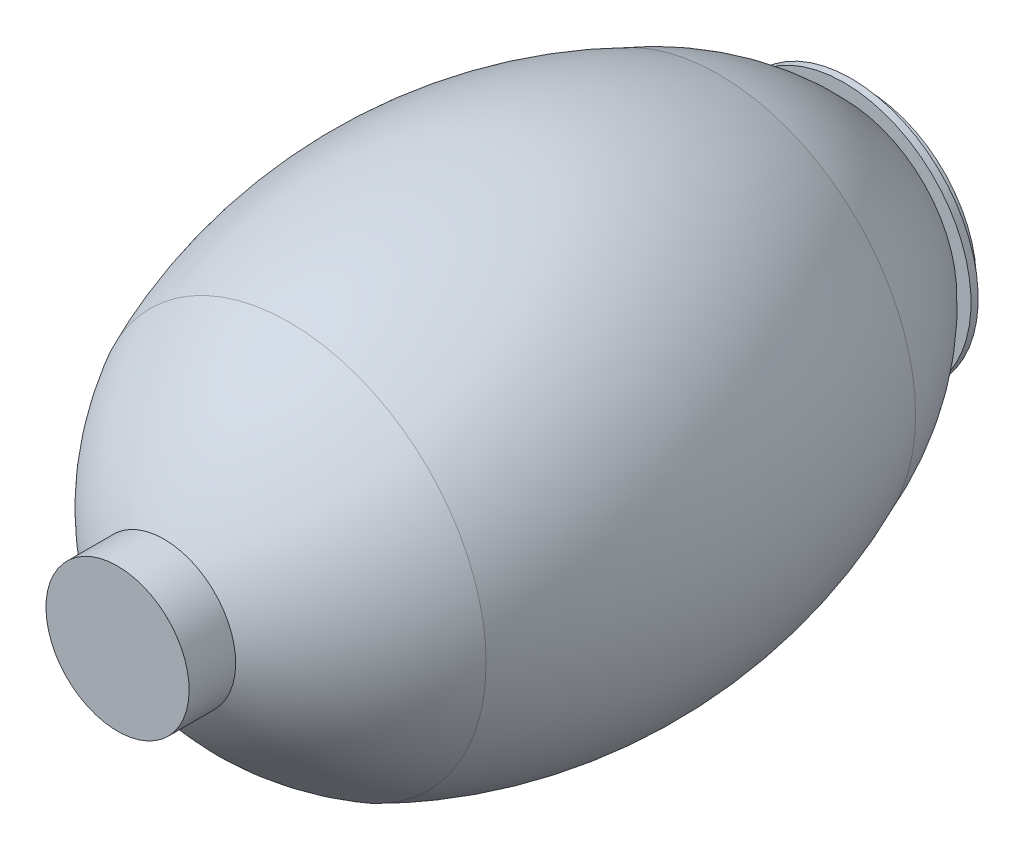
from build123d import *


with BuildPart() as part:
    # Sketch1 → Revolve1 (revolve)
    with BuildSketch(Plane(origin=(0, 0, 0), x_dir=(0, 0, -1), z_dir=(1, 0, 0))):
        with BuildLine():
            ThreePointArc((168, 55), (186.895377255, 45.328221444), (203, 31.5))
            Line((203, 31.5), (203, 35.5))
            Line((203, 35.5), (205, 35.5))
            Line((205, 35.5), (205, 31))
            Line((205, 31), (209, 31))
            Line((209, 31), (209, 0))
            Line((209, 0), (0, 0))
            Line((0, 0), (0, 20))
            Line((0, 20), (13, 20))
            ThreePointArc((13, 20), (28.046580946, 39.953419054), (48, 55))
            ThreePointArc((48, 55), (108, 67.5), (168, 55))
        make_face()
    revolve(axis=Axis((0, 0, -209), (0, 0, 1)))


solid = part.part
